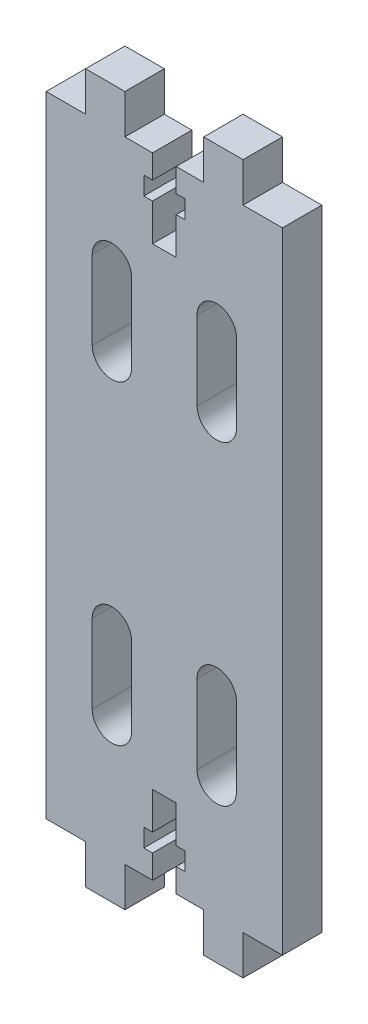
from build123d import *

# Parameters (mm, degrees)
BOSS_EXTRUDE1_DEPTH = 5


with BuildPart() as part:
    # Sketch1 → Boss-Extrude1 (new body)
    with BuildSketch(Plane.XY):
        Polygon((-10, 40), (-15, 40), (-15, -40), (-10, -40), (-10, -45), (-5, -45), (-5, -40), (-1.5, -40), (-1.5, -37), (-2.6, -37), (-2.6, -34.7), (-1.5, -34.7), (-1.5, -30), (1.5, -30), (1.5, -34.7), (2.6, -34.7), (2.6, -37), (1.5, -37), (1.5, -40), (5, -40), (5, -45), (10, -45), (10, -40), (15, -40), (15, 40), (10, 40), (10, 45), (5, 45), (5, 40), (1.5, 40), (1.5, 37), (2.6, 37), (2.6, 34.7), (1.5, 34.7), (1.5, 30), (-1.5, 30), (-1.5, 34.7), (-2.6, 34.7), (-2.6, 37), (-1.5, 37), (-1.5, 40), (-5, 40), (-5, 45), (-10, 45), align=None)
        with BuildLine():
            ThreePointArc((-4.156470727, -25), (-6.656470727, -27.5), (-9.156470727, -25))
            Line((-9.156470727, -25), (-9.156470727, -15))
            ThreePointArc((-9.156470727, -15), (-6.656470727, -12.5), (-4.156470727, -15))
            Line((-4.156470727, -15), (-4.156470727, -25))
        make_face(mode=Mode.SUBTRACT)
        with BuildLine():
            Line((9.156470727, -15), (9.156470727, -25))
            ThreePointArc((9.156470727, -25), (6.656470727, -27.5), (4.156470727, -25))
            Line((4.156470727, -25), (4.156470727, -15))
            ThreePointArc((4.156470727, -15), (6.656470727, -12.5), (9.156470727, -15))
        make_face(mode=Mode.SUBTRACT)
        with BuildLine():
            Line((-9.156470727, 15), (-9.156470727, 25))
            ThreePointArc((-9.156470727, 25), (-6.656470727, 27.5), (-4.156470727, 25))
            Line((-4.156470727, 25), (-4.156470727, 15))
            ThreePointArc((-4.156470727, 15), (-6.656470727, 12.5), (-9.156470727, 15))
        make_face(mode=Mode.SUBTRACT)
        with BuildLine():
            ThreePointArc((4.156470727, 25), (6.656470727, 27.5), (9.156470727, 25))
            Line((9.156470727, 25), (9.156470727, 15))
            ThreePointArc((9.156470727, 15), (6.656470727, 12.5), (4.156470727, 15))
            Line((4.156470727, 15), (4.156470727, 25))
        make_face(mode=Mode.SUBTRACT)
    extrude(amount=BOSS_EXTRUDE1_DEPTH)


solid = part.part
